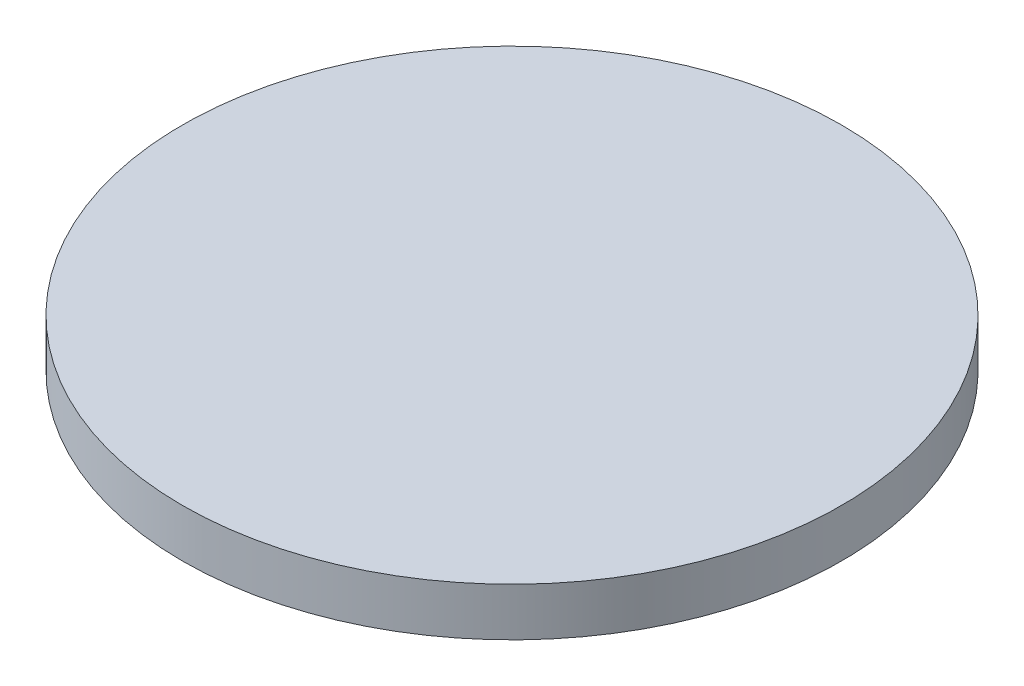
from build123d import *

# Parameters (mm, degrees)
SKETCH1_R           = 68.410969512
BOSS_EXTRUDE1_DEPTH = 10


with BuildPart() as part:
    # Sketch1 → Boss-Extrude1 (new body)
    with BuildSketch(Plane(origin=(0, 0, 0), x_dir=(1, 0, 0), z_dir=(0, 1, 0))):
        with Locations(Location((0, 0, 0), (0, 0, 270))):
            Circle(SKETCH1_R)
    extrude(amount=BOSS_EXTRUDE1_DEPTH)


solid = part.part
